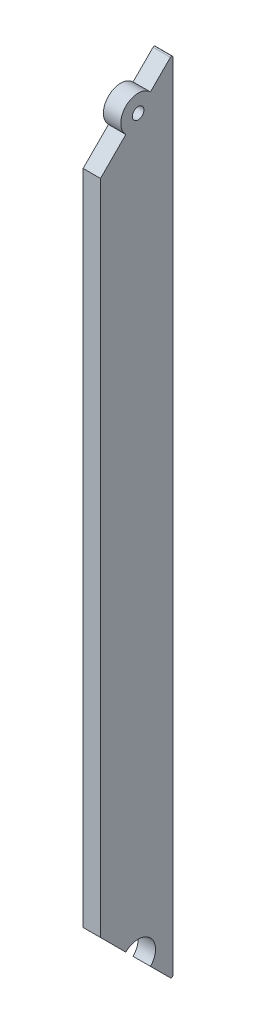
from build123d import *

# Parameters (mm, degrees)
BOSS_EXTRUDE1_DEPTH = 6
FILLET1_R           = 0.5
SKETCH4_R           = 6
BOSS_EXTRUDE2_DEPTH = 6
SKETCH3_R           = 2
SKETCH3_R_2         = 6
CUT_EXTRUDE1_DEPTH  = 284.694910827


with BuildPart() as part:
    # Sketch2 → Boss-Extrude1 (new body)
    with BuildSketch(Plane(origin=(0, 0, 0), x_dir=(0, 0, -1), z_dir=(1, 0, 0))):
        Polygon((-30.67492643, 30.67492643), (-30.67492643, 257.67492643), (-5.67492643, 282.67492643), (-5.67492643, 5.67492643), align=None)
    extrude(amount=BOSS_EXTRUDE1_DEPTH)

    # Fillet1
    fillet1_edges = [part.edges().sort_by_distance(p)[0] for p in [
        (3, 282.67492643, 5.67492643),
        (3, 5.67492643, 5.67492643),
    ]]
    fillet(fillet1_edges, radius=FILLET1_R)

    # Sketch4 → Boss-Extrude2 (add)
    with BuildSketch(Plane(origin=(6, 0, 0), x_dir=(0, 0, -1), z_dir=(1, 0, 0))):
        with Locations((-17.67492643, 270.67492643)):
            Circle(SKETCH4_R)
    extrude(amount=-BOSS_EXTRUDE2_DEPTH)

    # Sketch3 → Cut-Extrude1 (cut, through all)
    with BuildSketch(Plane(origin=(6, 0, 0), x_dir=(0, 0, -1), z_dir=(1, 0, 0))):
        with Locations((-17.67492643, 270.67492643)):
            Circle(SKETCH3_R)
        with Locations((-17.67492643, 17.67492643)):
            Circle(SKETCH3_R_2)
    extrude(amount=-CUT_EXTRUDE1_DEPTH, mode=Mode.SUBTRACT)


solid = part.part
